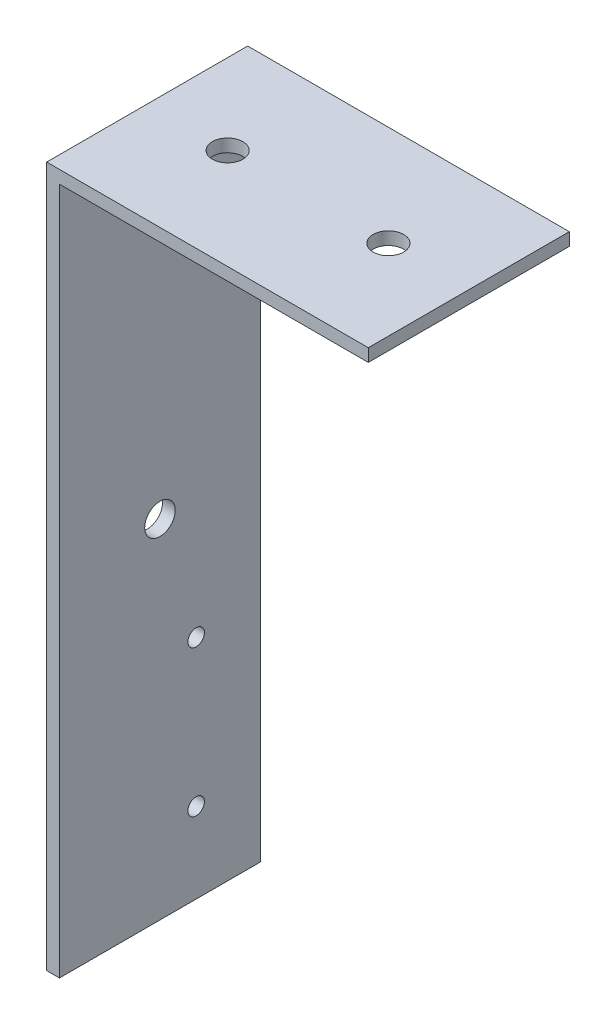
from build123d import *

# Parameters (mm, degrees)
BOSS_EXTRUDE1_DEPTH   = 25
F_6_CLEARANCE_HOLE1_D = 3.7973
F_1_CLEARANCE_HOLE2_D = 2.0574
F_6_CLEARANCE_HOLE2_D = 3.7973


with BuildPart() as part:
    # Sketch2 → Boss-Extrude1 (new body)
    with BuildSketch(Plane.XY):
        Polygon((0, 0), (0, 87.1), (40, 87.1), (40, 85.5125), (1.5875, 85.5125), (1.5875, 0), align=None)
    extrude(amount=BOSS_EXTRUDE1_DEPTH)

    # #6 Clearance Hole1 (through all)
    with Locations(Plane(origin=(0, 87.1, 0), x_dir=(1, 0, 0), z_dir=(0, 1, 0))):
        with Locations((10, -12.5), (30, -12.5)):
            Hole(F_6_CLEARANCE_HOLE1_D / 2)

    # #1 Clearance Hole2 (through all)
    with Locations(Plane.ZY):
        with Locations((8, 10), (8, 28.2)):
            Hole(F_1_CLEARANCE_HOLE2_D / 2)

    # #6 Clearance Hole2 (through all)
    with Locations(Plane.ZY):
        with Locations((12.5, 43.2)):
            Hole(F_6_CLEARANCE_HOLE2_D / 2)


solid = part.part
